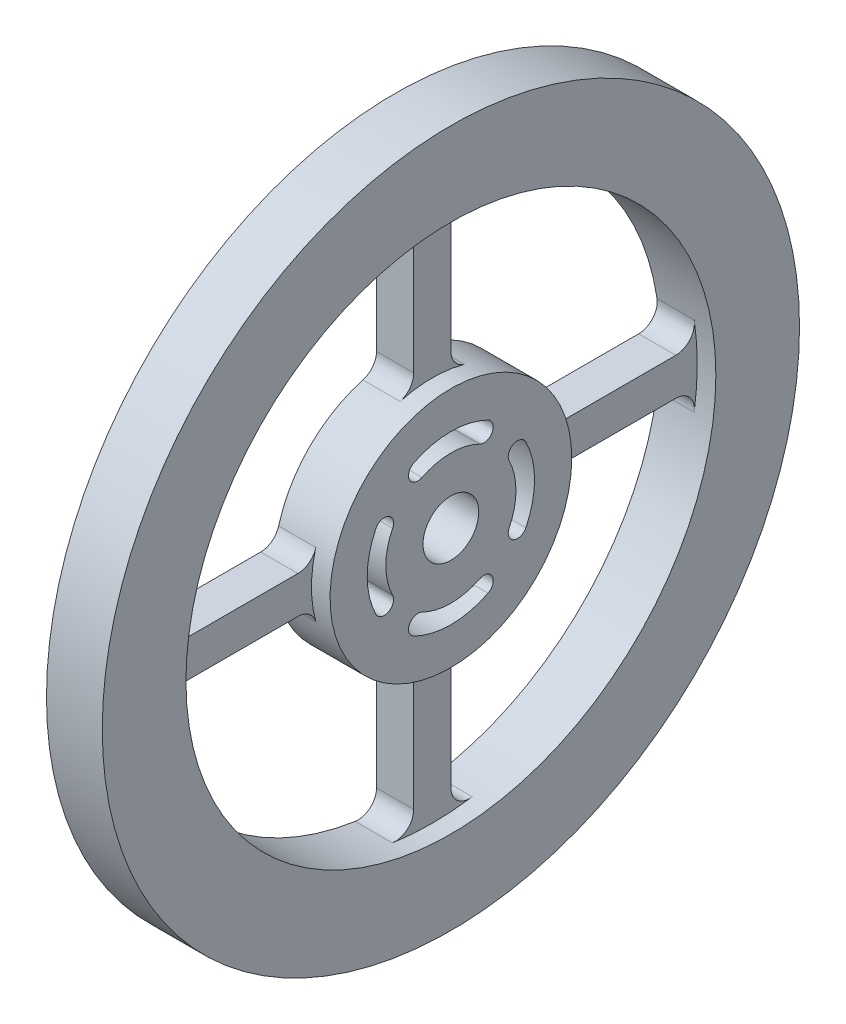
from build123d import *

# Parameters (mm, degrees)
SKETCH1_R           = 37.5
SKETCH1_R_2         = 3
BOSS_EXTRUDE1_DEPTH = 6
FILLET1_R           = 2
SKETCH2_R           = 1
CUT_EXTRUDE1_DEPTH  = 10
CIRPATTERN1_COUNT   = 4
CUT_EXTRUDE2_START  = -2
SKETCH3_R           = 28.5
SKETCH3_R_2         = 13
CUT_EXTRUDE2_DEPTH  = 2


with BuildPart() as part:
    # Sketch1 → Boss-Extrude1 (new body)
    with BuildSketch(Plane(origin=(0, 0, 0), x_dir=(0, 0, -1), z_dir=(1, 0, 0))):
        Circle(SKETCH1_R)
        with BuildLine():
            ThreePointArc((-12.845232579, -2), (-9.192388155, -9.192388155), (-2, -12.845232579))
            Line((-2, -12.845232579), (-2, -28.429737952))
            ThreePointArc((-2, -28.429737952), (-20.152543264, -20.152543264), (-28.429737952, -2))
            Line((-28.429737952, -2), (-12.845232579, -2))
        make_face(mode=Mode.SUBTRACT)
        with BuildLine():
            ThreePointArc((2, -12.845232579), (9.192388155, -9.192388155), (12.845232579, -2))
            Line((12.845232579, -2), (28.429737952, -2))
            ThreePointArc((28.429737952, -2), (20.152543264, -20.152543264), (2, -28.429737952))
            Line((2, -28.429737952), (2, -12.845232579))
        make_face(mode=Mode.SUBTRACT)
        Circle(SKETCH1_R_2, mode=Mode.SUBTRACT)
        with BuildLine():
            ThreePointArc((-2, 12.845232579), (-9.192388155, 9.192388155), (-12.845232579, 2))
            Line((-12.845232579, 2), (-28.429737952, 2))
            ThreePointArc((-28.429737952, 2), (-20.152543264, 20.152543264), (-2, 28.429737952))
            Line((-2, 28.429737952), (-2, 12.845232579))
        make_face(mode=Mode.SUBTRACT)
        with BuildLine():
            ThreePointArc((12.845232579, 2), (9.192388155, 9.192388155), (2, 12.845232579))
            Line((2, 12.845232579), (2, 28.429737952))
            ThreePointArc((2, 28.429737952), (20.152543264, 20.152543264), (28.429737952, 2))
            Line((28.429737952, 2), (12.845232579, 2))
        make_face(mode=Mode.SUBTRACT)
    extrude(amount=BOSS_EXTRUDE1_DEPTH)

    # Fillet1
    fillet1_edges = [part.edges().sort_by_distance(p)[0] for p in [
        (3, 28.429737952, -2),
        (3, 12.845232579, -2),
        (3, 2, -12.845232579),
        (3, 2, -28.429737952),
        (3, 28.429737952, 2),
        (3, 2, 28.429737952),
        (3, 2, 12.845232579),
        (3, 12.845232579, 2),
        (3, -2, 28.429737952),
        (3, -28.429737952, 2),
        (3, -2, 12.845232579),
        (3, -28.429737952, -2),
        (3, -2, -28.429737952),
        (3, -2, -12.845232579),
        (3, -12.845232579, -2),
    ]]
    fillet(fillet1_edges, radius=FILLET1_R)

    # Sketch2 → Cut-Extrude1 (cut)
    with BuildSketch(Plane(origin=(6, 0, 0), x_dir=(0, 0, -1), z_dir=(1, 0, 0))):
        with BuildLine():
            ThreePointArc((4, 8.062257748), (2.054224947, 8.762428879), (0, 9))
            ThreePointArc((0, 9), (-2.054224947, 8.762428879), (-4, 8.062257748))
            ThreePointArc((-4, 8.062257748), (-3.028509279, 8.016287917), (-2.555555556, 7.166451332))
            ThreePointArc((-2.555555556, 7.166451332), (-2.70571897, 6.639405055), (-3.111111111, 6.270644915))
            ThreePointArc((-3.111111111, 6.270644915), (-1.597730514, 6.815222462), (0, 7))
            ThreePointArc((0, 7), (1.597730514, 6.815222462), (3.111111111, 6.270644915))
            ThreePointArc((3.111111111, 6.270644915), (2.659749139, 7.610895776), (4, 8.062257748))
        make_face()
        with Locations((-3.555555556, 7.166451332)):
            Circle(SKETCH2_R)
        with Locations((3.555555556, 7.166451332)):
            Circle(SKETCH2_R)
    cut_extrude1 = extrude(amount=-CUT_EXTRUDE1_DEPTH, mode=Mode.SUBTRACT)

    # CirPattern1: Cut-Extrude1 ×4 about axis
    cirpattern1_axis = Axis((0, 0, 0), (1, 0, 0))
    for i in range(1, CIRPATTERN1_COUNT):
        add(cut_extrude1.rotate(cirpattern1_axis, i * 360 / CIRPATTERN1_COUNT), mode=Mode.SUBTRACT)

    # Sketch3 → Cut-Extrude2 (cut)
    with BuildSketch(Plane(origin=(6, 0, 0), x_dir=(0, 0, -1), z_dir=(1, 0, 0)).offset(CUT_EXTRUDE2_START)):
        with Locations(Location((0, 0, 0), (0, 0, 171.318398303))):
            Circle(SKETCH3_R)
        with Locations(Location((0, 0, 0), (0, 0, 164.533990047))):
            Circle(SKETCH3_R_2, mode=Mode.SUBTRACT)
    extrude(amount=CUT_EXTRUDE2_DEPTH, mode=Mode.SUBTRACT)


solid = part.part
